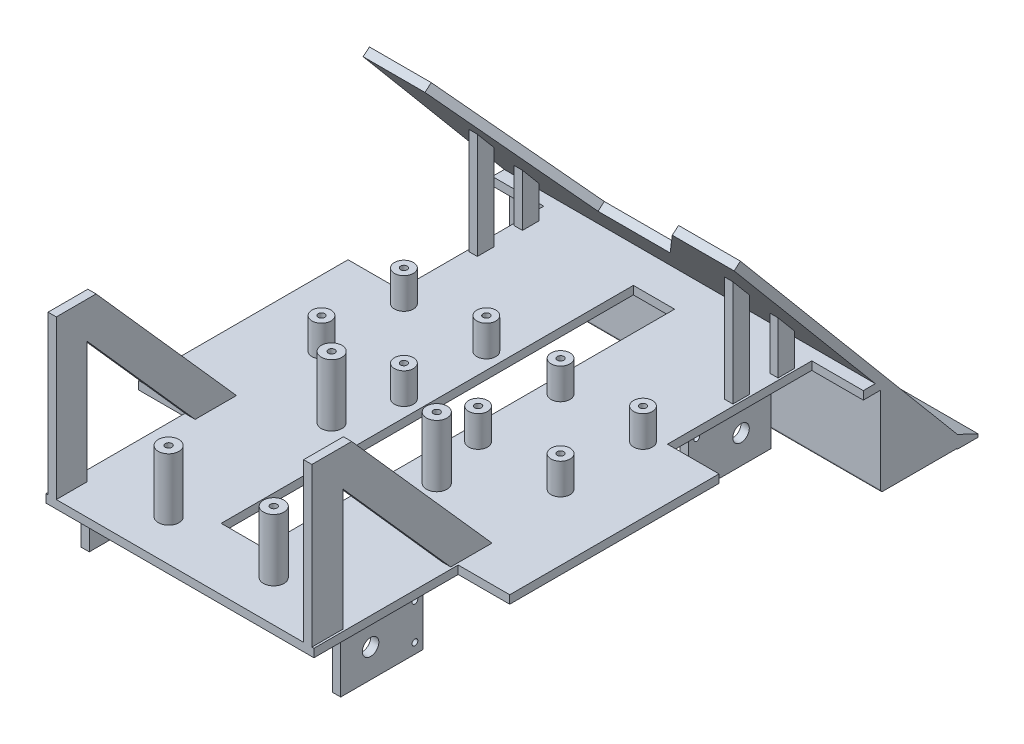
from build123d import *

# Parameters (mm, degrees)
SKETCH1_W            = 180
SKETCH1_H            = 250
BOSS_EXTRUDE1_DEPTH  = 4
SKETCH3_W            = 180
SKETCH3_H            = 7.078404721
CUT_EXTRUDE1_DEPTH   = 2
SKETCH4_W            = 180
SKETCH4_H            = 168.5595632
BOSS_EXTRUDE3_DEPTH  = 4
CUT_EXTRUDE2_DEPTH   = 214
SKETCH6_W            = 4
SKETCH6_H            = 40
BOSS_EXTRUDE4_DEPTH  = 25
SKETCH7_W            = 80
SKETCH7_H            = 50
CUT_EXTRUDE3_DEPTH   = 5
SKETCH8_R            = 1.4
CUT_EXTRUDE4_DEPTH   = 155
SKETCH10_W           = 50
SKETCH10_H           = 6.222895308
BOSS_EXTRUDE5_DEPTH  = 10
CUT_EXTRUDE5_DEPTH   = 199
SKETCH12_W           = 20
SKETCH12_H           = 200
CUT_EXTRUDE6_DEPTH   = 5
SKETCH13_R           = 5
SKETCH13_R_2         = 1.6
BOSS_EXTRUDE6_DEPTH  = 30
SKETCH14_R           = 4.6
SKETCH14_R_2         = 1.6
BOSS_EXTRUDE7_DEPTH  = 15
BOSS_EXTRUDE8_DEPTH  = 4
BOSS_EXTRUDE9_DEPTH  = 4
SKETCH17_W           = 25
SKETCH17_H           = 70
CUT_EXTRUDE8_DEPTH   = 19
SKETCH18_R           = 4
CUT_EXTRUDE9_DEPTH   = 145
BOSS_EXTRUDE10_DEPTH = 180
SKETCH27_W           = 80
SKETCH27_H           = 3.378884896
BOSS_EXTRUDE17_DEPTH = 3
BOSS_EXTRUDE13_DEPTH = 3
BOSS_EXTRUDE14_DEPTH = 3
BOSS_EXTRUDE15_DEPTH = 3
BOSS_EXTRUDE16_DEPTH = 3
FILLET1_R            = 1
SKETCH28_W           = 80
SKETCH28_H           = 34.31128583
CUT_EXTRUDE14_DEPTH  = 3


with BuildPart() as part:
    # Sketch1 → Boss-Extrude1 (new body)
    with BuildSketch(Plane(origin=(0, 0, 0), x_dir=(1, 0, 0), z_dir=(0, 1, 0))):
        with Locations((90, 125)):
            Rectangle(SKETCH1_W, SKETCH1_H)
    extrude(amount=BOSS_EXTRUDE1_DEPTH)

    # Sketch3 → Cut-Extrude1 (cut)
    with BuildSketch(Plane(origin=(0, 124.753672771, -148.675637714), x_dir=(-1, 0, 0), z_dir=(0, 0.6427876096865376, -0.7660444431189795))):
        with Locations((-90, -157.157700062)):
            Rectangle(SKETCH3_W, SKETCH3_H)
    extrude(amount=-CUT_EXTRUDE1_DEPTH, mode=Mode.SUBTRACT)

    # Sketch4 → Boss-Extrude3 (add)
    with BuildSketch(Plane(origin=(0, 123.468097552, -147.143548828), x_dir=(-1, 0, 0), z_dir=(0, 0.6427876096865368, -0.7660444431189802))):
        with Locations((-90, -133.637022031)):
            Rectangle(SKETCH4_W, SKETCH4_H)
    extrude(amount=BOSS_EXTRUDE3_DEPTH)

    # Sketch5 → Cut-Extrude2 (cut)
    with BuildSketch(Plane.ZY):
        Polygon((-287.217770145, -43.465858932), (-287.217770145, -37.242963624), (-290.281947917, -40.894708493), align=None)
    extrude(amount=-CUT_EXTRUDE2_DEPTH, mode=Mode.SUBTRACT)

    # Sketch6 → Boss-Extrude4 (add)
    with BuildSketch(Plane.XZ):
        with Locations((29, -203.745583946)):
            Rectangle(SKETCH6_W, SKETCH6_H)
        with Locations((29, -35)):
            Rectangle(SKETCH6_W, SKETCH6_H)
        with Locations((151, -203.745583946)):
            Rectangle(SKETCH6_W, SKETCH6_H)
        with Locations((151, -35)):
            Rectangle(SKETCH6_W, SKETCH6_H)
    extrude(amount=BOSS_EXTRUDE4_DEPTH)

    # Sketch7 → Cut-Extrude3 (cut)
    with BuildSketch(Plane(origin=(0, 126.039247991, -150.207726601), x_dir=(-1, 0, 0), z_dir=(0, 0.6427876096865365, -0.7660444431189805))):
        with Locations((-90, -192.916803631)):
            Rectangle(SKETCH7_W, SKETCH7_H)
        Polygon((-150, -49.357240431), (-107.5, -113.87549192), (-72.5, -113.87549192), (-30, -49.357240431), align=None)
    extrude(amount=-CUT_EXTRUDE3_DEPTH, mode=Mode.SUBTRACT)

    # Sketch8 → Cut-Extrude4 (cut)
    with BuildSketch(Plane.ZY.offset(-27)):
        with Locations((-187.745583946, -2.5)):
            Circle(SKETCH8_R)
        with Locations((-187.745583946, -20)):
            Circle(SKETCH8_R)
        with Locations((-51, -2.5)):
            Circle(SKETCH8_R)
        with Locations((-51, -20)):
            Circle(SKETCH8_R)
    extrude(amount=-CUT_EXTRUDE4_DEPTH, mode=Mode.SUBTRACT)

    # Sketch10 → Boss-Extrude5 (add)
    with BuildSketch(Plane(origin=(0, 0, -287.217770145), x_dir=(-1, 0, 0), z_dir=(0, 0, -1))):
        with Locations((-155, -40.354411278)):
            Rectangle(SKETCH10_W, SKETCH10_H)
        with Locations((-25, -40.354411278)):
            Rectangle(SKETCH10_W, SKETCH10_H)
    extrude(amount=BOSS_EXTRUDE5_DEPTH)

    # Sketch11 → Cut-Extrude5 (cut)
    with BuildSketch(Plane.ZY):
        Polygon((-297.217770145, -41.965858932), (-287.217770145, -37.242963624), (-297.217770145, -37.242963624), align=None)
    extrude(amount=-CUT_EXTRUDE5_DEPTH, mode=Mode.SUBTRACT)

    # Sketch12 → Cut-Extrude6 (cut)
    with BuildSketch(Plane(origin=(0, 4, 0), x_dir=(1, 0, 0), z_dir=(0, 1, 0))):
        with Locations((90, 130)):
            Rectangle(SKETCH12_W, SKETCH12_H)
    extrude(amount=-CUT_EXTRUDE6_DEPTH, mode=Mode.SUBTRACT)

    # Sketch13 → Boss-Extrude6 (add)
    # profile 1 of 4: a face of its own
    with BuildSketch(Plane(origin=(0, 4, 0), x_dir=(1, 0, 0), z_dir=(0, 1, 0))):
        with Locations(Location((64.5, 99.1, 0), (0, 0, 90))):
            Circle(SKETCH13_R)
        with Locations(Location((64.5, 99.1, 0), (0, 0, 270))):
            Circle(SKETCH13_R_2, mode=Mode.SUBTRACT)
    # profile 2 of 4: a face of its own
    with BuildSketch(Plane(origin=(0, 4, 0), x_dir=(1, 0, 0), z_dir=(0, 1, 0))):
        with Locations(Location((115.5, 99.1, 0), (0, 0, 90))):
            Circle(SKETCH13_R)
        with Locations(Location((115.5, 99.1, 0), (0, 0, 270))):
            Circle(SKETCH13_R_2, mode=Mode.SUBTRACT)
    # profile 3 of 4: a face of its own
    with BuildSketch(Plane(origin=(0, 4, 0), x_dir=(1, 0, 0), z_dir=(0, 1, 0))):
        with Locations(Location((115.5, 20, 0), (0, 0, 90))):
            Circle(SKETCH13_R)
        with Locations(Location((115.5, 20, 0), (0, 0, 270))):
            Circle(SKETCH13_R_2, mode=Mode.SUBTRACT)
    # profile 4 of 4: a face of its own
    with BuildSketch(Plane(origin=(0, 4, 0), x_dir=(1, 0, 0), z_dir=(0, 1, 0))):
        with Locations(Location((64.5, 20, 0), (0, 0, 90))):
            Circle(SKETCH13_R)
        with Locations(Location((64.5, 20, 0), (0, 0, 270))):
            Circle(SKETCH13_R_2, mode=Mode.SUBTRACT)
    extrude(amount=BOSS_EXTRUDE6_DEPTH)

    # Sketch14 → Boss-Extrude7 (add)
    # profile 1 of 8: a face of its own
    with BuildSketch(Plane(origin=(0, 4, 0), x_dir=(1, 0, 0), z_dir=(0, 1, 0))):
        with Locations(Location((32, 166.671215293, 0), (0, 0, 90))):
            Circle(SKETCH14_R)
        with Locations(Location((32, 166.671215293, 0), (0, 0, 270))):
            Circle(SKETCH14_R_2, mode=Mode.SUBTRACT)
    # profile 2 of 8: a face of its own
    with BuildSketch(Plane(origin=(0, 4, 0), x_dir=(1, 0, 0), z_dir=(0, 1, 0))):
        with Locations(Location((72, 166.671215293, 0), (0, 0, 90))):
            Circle(SKETCH14_R)
        with Locations(Location((72, 166.671215293, 0), (0, 0, 270))):
            Circle(SKETCH14_R_2, mode=Mode.SUBTRACT)
    # profile 3 of 8: a face of its own
    with BuildSketch(Plane(origin=(0, 4, 0), x_dir=(1, 0, 0), z_dir=(0, 1, 0))):
        with Locations(Location((72, 126.671215293, 0), (0, 0, 90))):
            Circle(SKETCH14_R)
        with Locations(Location((72, 126.671215293, 0), (0, 0, 270))):
            Circle(SKETCH14_R_2, mode=Mode.SUBTRACT)
    # profile 4 of 8: a face of its own
    with BuildSketch(Plane(origin=(0, 4, 0), x_dir=(1, 0, 0), z_dir=(0, 1, 0))):
        with Locations(Location((32, 126.671215293, 0), (0, 0, 90))):
            Circle(SKETCH14_R)
        with Locations(Location((32, 126.671215293, 0), (0, 0, 270))):
            Circle(SKETCH14_R_2, mode=Mode.SUBTRACT)
    # profile 5 of 8: a face of its own
    with BuildSketch(Plane(origin=(0, 4, 0), x_dir=(1, 0, 0), z_dir=(0, 1, 0))):
        with Locations(Location((108, 166.671215293, 0), (0, 0, 90))):
            Circle(SKETCH14_R)
        with Locations(Location((108, 166.671215293, 0), (0, 0, 270))):
            Circle(SKETCH14_R_2, mode=Mode.SUBTRACT)
    # profile 6 of 8: a face of its own
    with BuildSketch(Plane(origin=(0, 4, 0), x_dir=(1, 0, 0), z_dir=(0, 1, 0))):
        with Locations(Location((148, 166.671215293, 0), (0, 0, 90))):
            Circle(SKETCH14_R)
        with Locations(Location((148, 166.671215293, 0), (0, 0, 270))):
            Circle(SKETCH14_R_2, mode=Mode.SUBTRACT)
    # profile 7 of 8: a face of its own
    with BuildSketch(Plane(origin=(0, 4, 0), x_dir=(1, 0, 0), z_dir=(0, 1, 0))):
        with Locations(Location((148, 126.671215293, 0), (0, 0, 90))):
            Circle(SKETCH14_R)
        with Locations(Location((148, 126.671215293, 0), (0, 0, 270))):
            Circle(SKETCH14_R_2, mode=Mode.SUBTRACT)
    # profile 8 of 8: a face of its own
    with BuildSketch(Plane(origin=(0, 4, 0), x_dir=(1, 0, 0), z_dir=(0, 1, 0))):
        with Locations(Location((108, 126.671215293, 0), (0, 0, 90))):
            Circle(SKETCH14_R)
        with Locations(Location((108, 126.671215293, 0), (0, 0, 270))):
            Circle(SKETCH14_R_2, mode=Mode.SUBTRACT)
    extrude(amount=BOSS_EXTRUDE7_DEPTH)

    # Sketch15 → Boss-Extrude8 (add)
    with BuildSketch(Plane.ZY.offset(-30)):
        Polygon((0, 4), (0, 80.750364276), (-19.301891028, 80.750364276), (-87.419317565, 4), (-67.363636364, 4), (-15, 63), (-15, 4), align=None)
    boss_extrude8 = extrude(amount=BOSS_EXTRUDE8_DEPTH)

    # Mirror1: Boss-Extrude8 across plane
    add(boss_extrude8.mirror(Plane(origin=(90, 0, 0), x_dir=(0, 0, 1), z_dir=(1, 0, 0))))

    # Sketch16 → Boss-Extrude9 (add)
    with BuildSketch(Plane.ZY.offset(-30)):
        Polygon((-212.271069219, 45.852141149), (-212.271069219, 4), (-204.271069219, 4), (-204.271069219, 55.38616989), align=None)
        Polygon((-234.18477544, 19.736403034), (-234.18477544, 4), (-226.18477544, 4), (-226.18477544, 29.270431775), align=None)
    boss_extrude9 = extrude(amount=BOSS_EXTRUDE9_DEPTH)

    # Mirror2: Boss-Extrude9 across plane
    add(boss_extrude9.mirror(Plane(origin=(90, 0, 0), x_dir=(0, 0, 1), z_dir=(1, 0, 0))))

    # Sketch17 → Cut-Extrude8 (cut)
    with BuildSketch(Plane(origin=(0, 4, 0), x_dir=(1, 0, 0), z_dir=(0, 1, 0))):
        with Locations((12.5, 35)):
            Rectangle(SKETCH17_W, SKETCH17_H)
        with Locations((12.5, 206.553921427)):
            Rectangle(SKETCH17_W, SKETCH17_H)
    cut_extrude8 = extrude(amount=-CUT_EXTRUDE8_DEPTH, mode=Mode.SUBTRACT)

    # Sketch18 → Cut-Extrude9 (cut)
    with BuildSketch(Plane.ZY.offset(-27)):
        with Locations((-29.5, -11.2)):
            Circle(SKETCH18_R)
        with Locations((-209.245583946, -11.2)):
            Circle(SKETCH18_R)
    extrude(amount=-CUT_EXTRUDE9_DEPTH, mode=Mode.SUBTRACT)

    # Mirror3: Cut-Extrude8 across plane
    add(cut_extrude8.mirror(Plane(origin=(90, 0, 0), x_dir=(0, 0, 1), z_dir=(1, 0, 0))), mode=Mode.SUBTRACT)



with BuildPart() as body_2:
    # Sketch19 → Boss-Extrude10 (new body)
    with BuildSketch(Plane.ZY):
        Polygon((-250, 0.888552346), (-250, -43.052683021), (-287.710174021, -43.052683021), (-284.353775496, -40.052683021), (-252.906484315, -40.052683021), (-252.906484315, -2.575260778), align=None)
    extrude(amount=-BOSS_EXTRUDE10_DEPTH)


with BuildPart() as part_1:
    add(part.part)

    add(body_2.part)  # Boss-Extrude17 merges body 2
    # Sketch27 → Boss-Extrude17 (add)
    with BuildSketch(Plane(origin=(0, 123.468097552, -147.143548828), x_dir=(-1, 0, 0), z_dir=(0, 0.6427876096865226, -0.766044443118992))):
        with Locations((-90, -166.227361183)):
            Rectangle(SKETCH27_W, SKETCH27_H)
    extrude(amount=BOSS_EXTRUDE17_DEPTH)

    # Sketch23 → Boss-Extrude13 (add)
    with BuildSketch(Plane(origin=(50, 0, 0), x_dir=(0, 0, -1), z_dir=(1, 0, 0))):
        Polygon((250, 0.888552346), (287.710174021, -43.052683021), (250, -43.052683021), align=None)
    extrude(amount=-BOSS_EXTRUDE13_DEPTH)

    # Sketch24 → Boss-Extrude14 (add)
    with BuildSketch(Plane.ZY.offset(-130)):
        Polygon((-252.906484315, -2.575260778), (-252.906484315, -40.052683021), (-284.353775496, -40.052683021), align=None)
    extrude(amount=-BOSS_EXTRUDE14_DEPTH)

    # Sketch25 → Boss-Extrude15 (add)
    with BuildSketch(Plane.ZY):
        Polygon((-252.906484315, -2.575260778), (-252.906484315, -40.052683021), (-284.353775496, -40.052683021), align=None)
    extrude(amount=-BOSS_EXTRUDE15_DEPTH)

    # Sketch26 → Boss-Extrude16 (add)
    with BuildSketch(Plane(origin=(180, 0, 0), x_dir=(0, 0, -1), z_dir=(1, 0, 0))):
        Polygon((252.906484315, -2.575260778), (252.906484315, -40.052683021), (284.353775496, -40.052683021), align=None)
    extrude(amount=-BOSS_EXTRUDE16_DEPTH)

    # Fillet1
    fillet1_edges = [part_1.edges().sort_by_distance(p)[0] for p in [
        (90, -43.052683021, -250),
    ]]
    fillet(fillet1_edges, radius=FILLET1_R)

    # Sketch28 → Cut-Extrude14 (cut)
    with BuildSketch(Plane(origin=(0, -40.052683021, 0), x_dir=(1, 0, 0), z_dir=(0, 1, 0))):
        with Locations((90, 270.06212723)):
            Rectangle(SKETCH28_W, SKETCH28_H)
    extrude(amount=-CUT_EXTRUDE14_DEPTH, mode=Mode.SUBTRACT)


solid = part_1.part
